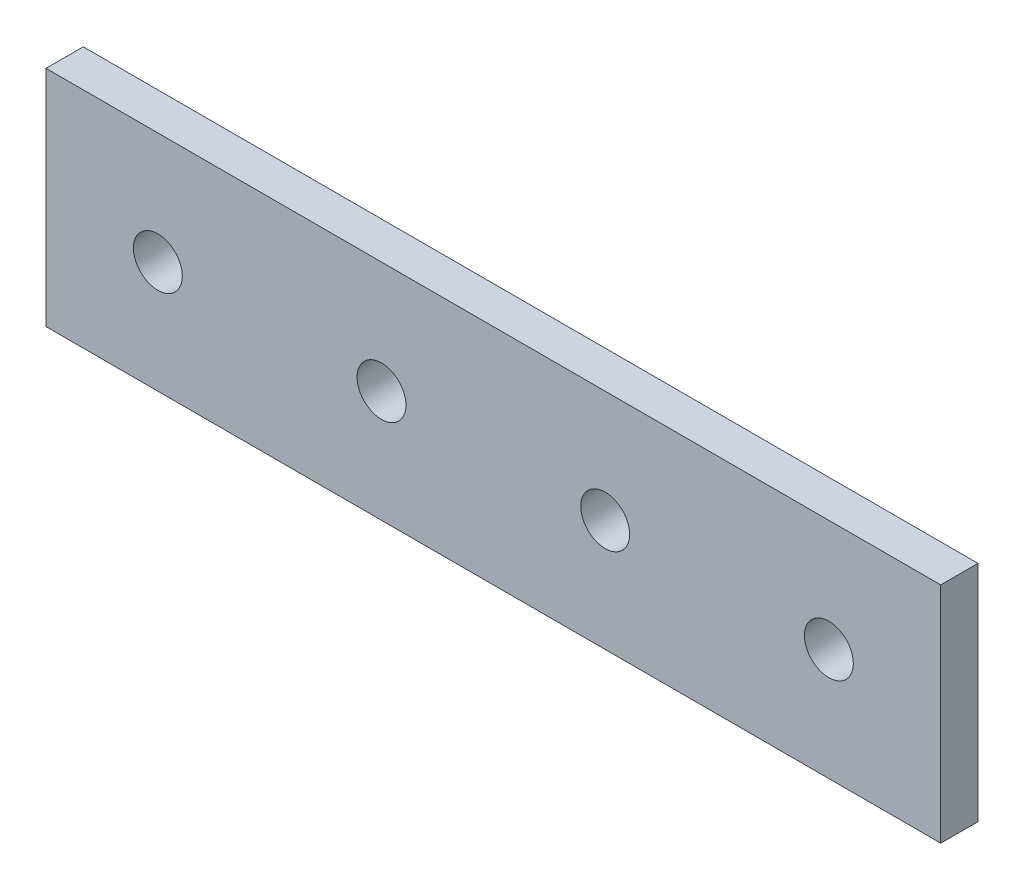
from build123d import *

# Parameters (mm, degrees)
SKETCH1_W           = 152.4
SKETCH1_H           = 38.1
SKETCH1_R           = 4.1656
BOSS_EXTRUDE1_DEPTH = 3.175


with BuildPart() as part:
    # Sketch1 → Boss-Extrude1 (new, symmetric)
    with BuildSketch(Plane.XY):
        with Locations((76.2, 19.05)):
            Rectangle(SKETCH1_W, SKETCH1_H)
        with Locations((19.05, 19.05)):
            Circle(SKETCH1_R, mode=Mode.SUBTRACT)
        with Locations((57.15, 19.05)):
            Circle(SKETCH1_R, mode=Mode.SUBTRACT)
        with Locations((95.25, 19.05)):
            Circle(SKETCH1_R, mode=Mode.SUBTRACT)
        with Locations((133.35, 19.05)):
            Circle(SKETCH1_R, mode=Mode.SUBTRACT)
    extrude(amount=BOSS_EXTRUDE1_DEPTH, both=True)


solid = part.part
